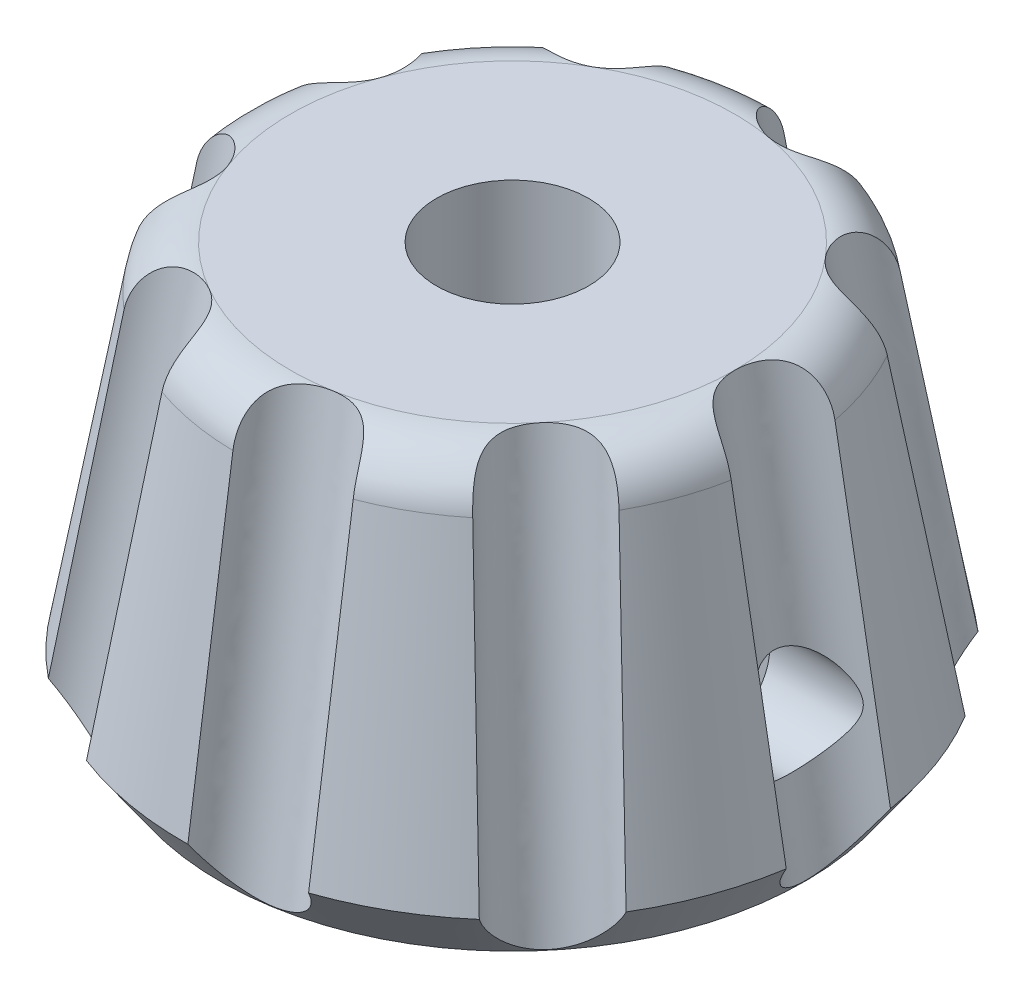
from build123d import *

# Parameters (mm, degrees)
FILLET1_R          = 2
CHAMFER1_SIZE      = 2
CHAMFER1_SIZE2     = 1.72643598
SKETCH2_R          = 1.969615506
CUT_EXTRUDE1_DEPTH = 24.179095168
CIRPATTERN1_COUNT  = 9
CUT_EXTRUDE2_DEPTH = 3
SKETCH6_R          = 1.8
CUT_EXTRUDE3_DEPTH = 23.811760555


with BuildPart() as part:
    # Sketch1 → Revolve1 (revolve)
    with BuildSketch(Plane.XY, mode=Mode.PRIVATE) as revolve1_sk:
        Polygon((2.8, 0), (2.8, 15), (9.855095289, 15), (12.5, 0), align=None)
    revolve(revolve1_sk.sketch.rotate(Axis((0, 0, 0), (0, 1, 0)), 90), axis=Axis((0, 0, 0), (0, 1, 0)))

    # Fillet1
    fillet1_edges = [part.edges().sort_by_distance(p)[0] for p in [
        (0, 15, 9.855095289),
    ]]
    fillet(fillet1_edges, radius=FILLET1_R)

    # Chamfer1
    chamfer1_edges = [part.edges().sort_by_distance(p)[0] for p in [
        (0, 0, 12.5),
    ]]
    chamfer1_side = [part.faces().sort_by_distance(p)[0] for p in [
        (0, 6.673648178, 11.323255767),
    ]]
    chamfer(chamfer1_edges, length=CHAMFER1_SIZE, length2=CHAMFER1_SIZE2, reference=chamfer1_side[0])

    # Sketch2 → Cut-Extrude1 (cut, through all, along a direction that is not the sketch's normal)
    with BuildSketch(Plane(origin=(0, 15, 0), x_dir=(1, 0, 0), z_dir=(0, 1, 0))):
        with Locations((10.146511533, 0)):
            Circle(SKETCH2_R)
    cut_extrude1 = extrude(amount=-CUT_EXTRUDE1_DEPTH, dir=(-0.17364817766693486, 0.9848077530122074, 0), mode=Mode.SUBTRACT)

    # CirPattern1: Cut-Extrude1 ×9 about axis
    cirpattern1_axis = Axis((0, 15, 0), (0, 1, 0))
    for i in range(1, CIRPATTERN1_COUNT):
        add(cut_extrude1.rotate(cirpattern1_axis, i * 360 / CIRPATTERN1_COUNT), mode=Mode.SUBTRACT)

    # Sketch4 → Cut-Extrude2 (cut)
    with BuildSketch(Plane(origin=(4.675, 0, 0), x_dir=(0, 0, -1), z_dir=(1, 0, 0))):
        Polygon((2.9, 3.325684219), (2.9, 6.674315781), (0, 8.348631561), (-2.9, 6.674315781), (-2.9, 3.325684219), (-2.9, 0), (2.9, 0), align=None)
    extrude(amount=CUT_EXTRUDE2_DEPTH, mode=Mode.SUBTRACT)

    # Sketch6 → Cut-Extrude3 (cut, through all)
    with BuildSketch(Plane(origin=(0, 0, 0), x_dir=(0, 0, -1), z_dir=(1, 0, 0))):
        with Locations(Location((0, 5, 0), (0, 0, 180))):
            Circle(SKETCH6_R)
    extrude(amount=CUT_EXTRUDE3_DEPTH, mode=Mode.SUBTRACT)


solid = part.part
